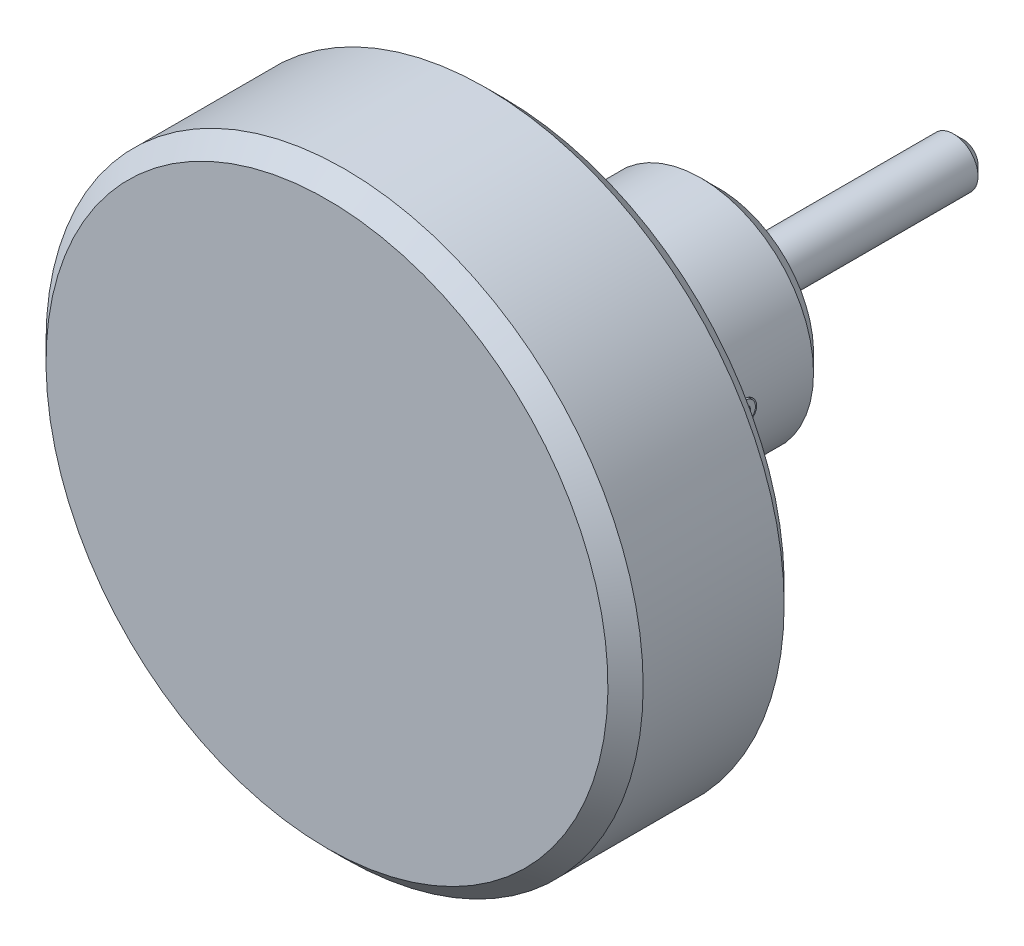
from build123d import *

# Parameters (mm, degrees)
SKETCH1_W      = 25
SKETCH1_H      = 2.5
CHAMFER1_SIZE  = 1
CHAMFER2_SIZE  = 1.8
SKETCH16_W     = 9.525
SKETCH16_H     = 1.190625
REVOLVE4_ANGLE = 325


with BuildPart() as part:
    # Sketch1 → Revolve1 (revolve)
    with BuildSketch(Plane(origin=(0, 0, 0), x_dir=(0, 0, -1), z_dir=(1, 0, 0))):
        with Locations((0, 1.25)):
            Rectangle(SKETCH1_W, SKETCH1_H)
    revolve(axis=Axis((0, 0, -12.5), (0, 0, 1)))

    # Sketch5 → Revolve3 (revolve)
    with BuildSketch(Plane(origin=(0, 0, 0), x_dir=(0, 0, -1), z_dir=(1, 0, 0))):
        Polygon((-12.5, 11.5), (-34.5, 11.5), (-34.5, 30.5), (-52.5, 30.5), (-52.5, 0), (-12.5, 0), align=None)
    revolve(axis=Axis((0, 0, 12.5), (0, 0, 1)))

    # Chamfer1
    chamfer1_edges = [part.edges().sort_by_distance(p)[0] for p in [
        (0, -2.5, -12.5),
    ]]
    chamfer(chamfer1_edges, length=CHAMFER1_SIZE)

    # Chamfer2
    chamfer2_edges = [part.edges().sort_by_distance(p)[0] for p in [
        (0, -30.5, 34.5),
        (0, -30.5, 52.5),
        (0, -11.5, 12.5),
    ]]
    chamfer(chamfer2_edges, length=CHAMFER2_SIZE)

    # Sketch16 → Cut-Revolve1 (revolve, cut)
    with BuildSketch(Plane.XY.offset(21.3)):
        with Locations((6.7375, 0.5953125)):
            Rectangle(SKETCH16_W, SKETCH16_H)
    revolve(axis=Axis((11.5, 0, 21.3), (-1, 0, 0)), mode=Mode.SUBTRACT)


with BuildPart() as body_2:
    # Sketch17 → Revolve4 (revolve, symmetric)
    with BuildSketch(Plane.XY.offset(21.3)) as revolve4_sk:
        Polygon((11.5, 1.065625572), (10.07125, 1.190625), (3.40375, 1.190625), (1.975, 1.065625572), (1.975, 0.557625572), (3.40375, 0.682625), (10.07125, 0.682625), (11.5, 0.557625572), align=None)
    revolve(axis=Axis((11.5, 0, 21.3), (-1, 0, 0)), revolution_arc=REVOLVE4_ANGLE / 2)
    revolve(revolve4_sk.sketch, axis=Axis((11.5, 0, 21.3), (1, 0, 0)), revolution_arc=REVOLVE4_ANGLE / 2)


solid = Compound([part.part, body_2.part])
